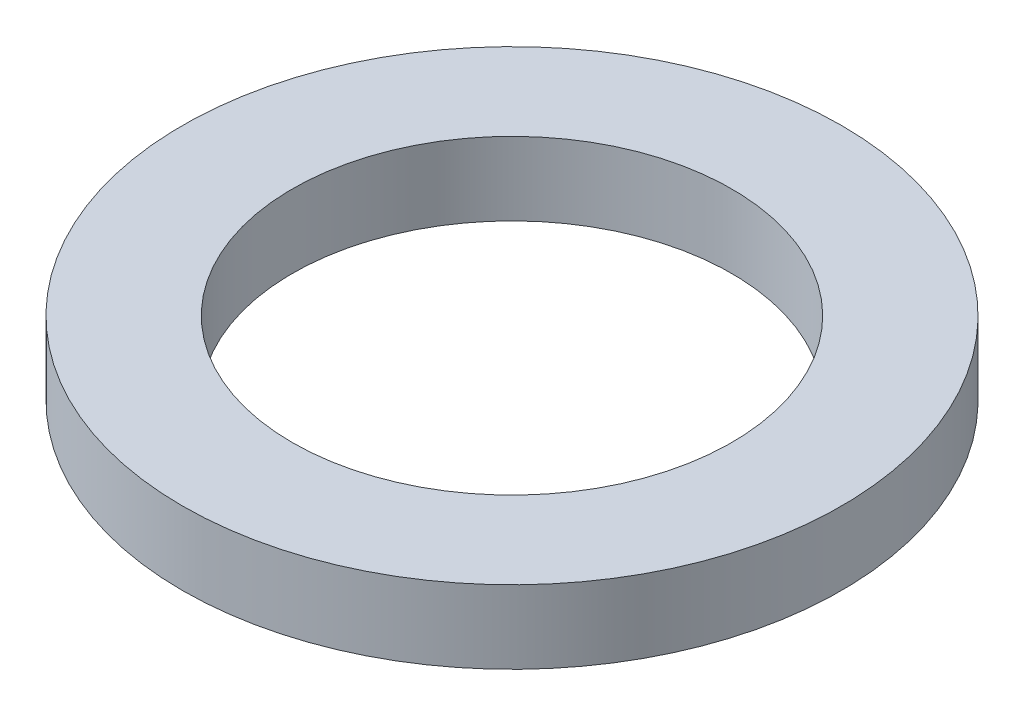
from build123d import *

# Parameters (mm, degrees)
SKETCH1_R           = 22.5
SKETCH1_R_2         = 15
BOSS_EXTRUDE1_DEPTH = 5


with BuildPart() as part:
    # Sketch1 → Boss-Extrude1 (new body)
    with BuildSketch(Plane(origin=(0, 0, 0), x_dir=(1, 0, 0), z_dir=(0, 1, 0))):
        with Locations(Location((0, 0, 0), (0, 0, 270))):
            Circle(SKETCH1_R)
        with Locations(Location((0, 0, 0), (0, 0, 270))):
            Circle(SKETCH1_R_2, mode=Mode.SUBTRACT)
    extrude(amount=BOSS_EXTRUDE1_DEPTH)


solid = part.part
